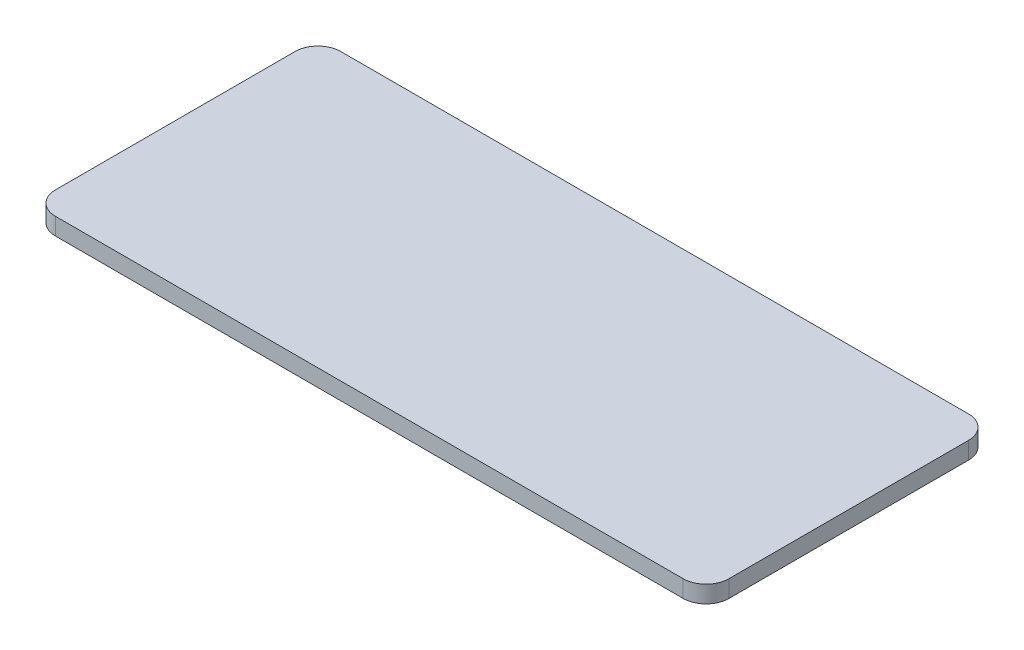
from build123d import *

# Parameters (mm, degrees)
SKETCH_1_W      = 590
SKETCH_1_H      = 250
EXTRUDE_1_DEPTH = 15
FILLET_1_R      = 20


with BuildPart() as part:
    # 草图1 → 凸台-拉伸1 (new body)
    with BuildSketch(Plane(origin=(0, 0, 0), x_dir=(1, 0, 0), z_dir=(0, 1, 0))):
        with Locations((680.912594327, 520.64148326)):
            Rectangle(SKETCH_1_W, SKETCH_1_H)
    extrude(amount=EXTRUDE_1_DEPTH)

    # 圆角1
    fillet_1_edges = [part.edges().sort_by_distance(p)[0] for p in [
        (385.912594327, 7.5, -645.64148326),
        (975.912594327, 7.5, -645.64148326),
        (975.912594327, 7.5, -395.64148326),
        (385.912594327, 7.5, -395.64148326),
    ]]
    fillet(fillet_1_edges, radius=FILLET_1_R)


solid = part.part
